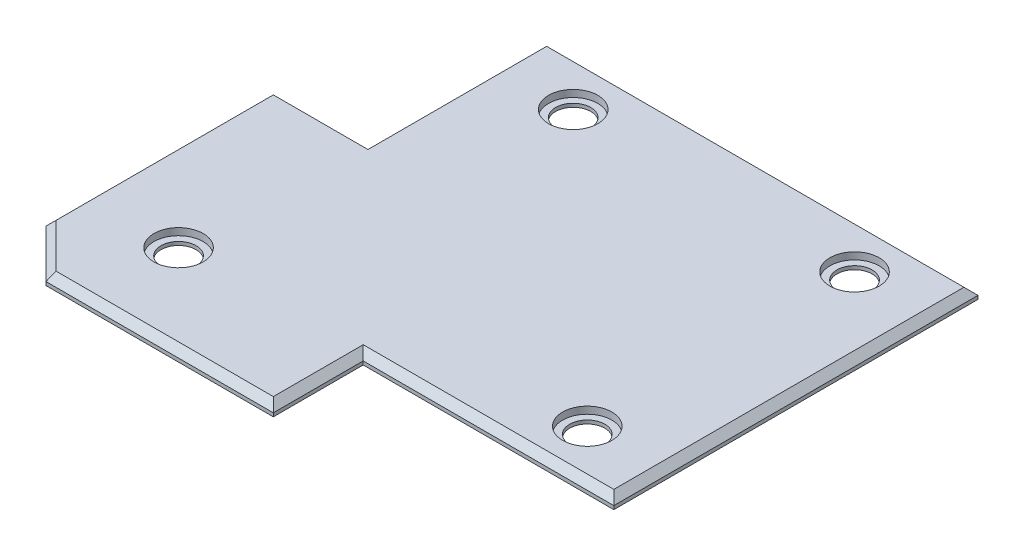
from build123d import *

# Parameters (mm, degrees)
BOSS_EXTRUDE1_DEPTH = 2
CHAMFER1_SIZE       = 8
BOSS_EXTRUDE2_DEPTH = 1.5
SKETCH4_W           = 99.768826376
SKETCH4_H           = 91.588754032
CUT_EXTRUDE1_DEPTH  = 2
SKETCH5_R           = 2.5
CUT_EXTRUDE2_DEPTH  = 2
SKETCH8_R           = 3.5
CUT_EXTRUDE3_DEPTH  = 1
CHAMFER2_SIZE       = 1


with BuildPart() as part:
    # Sketch1 → Boss-Extrude1 (new body)
    with BuildSketch(Plane(origin=(0, 0, 0), x_dir=(1, 0, 0), z_dir=(0, 1, 0))):
        Polygon((-1.782487159, -28.34466675), (33.85093234, -28.34466675), (33.85093234, 27.435918205), (-31.480603593, 27.435918205), (-31.480603593, 2.026433414), (-44.933505709, 2.026433414), (-44.933505709, -41.124585136), (-1.782487159, -41.124585136), align=None)
    extrude(amount=BOSS_EXTRUDE1_DEPTH)

    # Chamfer1
    chamfer1_edges = [part.edges().sort_by_distance(p)[0] for p in [
        (-44.933505709, 1, 41.124585136),
    ]]
    chamfer(chamfer1_edges, length=CHAMFER1_SIZE)

    # Sketch3 → Boss-Extrude2 (add)
    with BuildSketch(Plane(origin=(0, 2, 0), x_dir=(1, 0, 0), z_dir=(0, 1, 0))):
        Polygon((-29.480603593, 25.435918205), (31.85093234, 25.435918205), (31.85093234, -26.34466675), (-3.782487159, -26.34466675), (-3.782487159, -39.124585136), (-36.105078585, -39.124585136), (-42.933505709, -32.296158012), (-42.933505709, 0.026433414), (-29.480603593, 0.026433414), align=None)
    extrude(amount=BOSS_EXTRUDE2_DEPTH)

    # Sketch4 → Cut-Extrude1 (cut)
    with BuildSketch(Plane.XZ):
        Rectangle(SKETCH4_W, SKETCH4_H)
    extrude(amount=-CUT_EXTRUDE1_DEPTH, mode=Mode.SUBTRACT)

    # Sketch5 → Cut-Extrude2 (cut)
    with BuildSketch(Plane(origin=(0, 3.5, 0), x_dir=(1, 0, 0), z_dir=(0, 1, 0))):
        with Locations(Location((-18.814835626, 18.545625727, 0), (0, 0, 270))):
            Circle(SKETCH5_R)
        with Locations(Location((21.185164374, 18.545625727, 0), (0, 0, 270))):
            Circle(SKETCH5_R)
        with Locations(Location((21.185164374, -19.454374273, 0), (0, 0, 270))):
            Circle(SKETCH5_R)
        with Locations(Location((-29.854835626, -26.529137879, 0), (0, 0, 270))):
            Circle(SKETCH5_R)
    extrude(amount=-CUT_EXTRUDE2_DEPTH, mode=Mode.SUBTRACT)

    # Sketch8 → Cut-Extrude3 (cut)
    with BuildSketch(Plane(origin=(0, 3.5, 0), x_dir=(1, 0, 0), z_dir=(0, 1, 0))):
        with Locations(Location((-18.814835626, 18.545625727, 0), (0, 0, 270))):
            Circle(SKETCH8_R)
        with Locations(Location((21.185164374, 18.545625727, 0), (0, 0, 270))):
            Circle(SKETCH8_R)
        with Locations(Location((-29.854835626, -26.529137879, 0), (0, 0, 270))):
            Circle(SKETCH8_R)
        with Locations(Location((21.185164374, -19.454374273, 0), (0, 0, 270))):
            Circle(SKETCH8_R)
    extrude(amount=-CUT_EXTRUDE3_DEPTH, mode=Mode.SUBTRACT)

    # Chamfer2
    chamfer2_edges = [part.edges().sort_by_distance(p)[0] for p in [
        (-29.480603593, 3.5, -12.731175809),
        (-36.207054651, 3.5, -0.026433414),
        (-42.933505709, 3.5, 16.134862299),
        (-39.519292147, 3.5, 35.710371574),
        (-19.943782872, 3.5, 39.124585136),
        (-3.782487159, 3.5, 32.734625943),
        (14.034222591, 3.5, 26.34466675),
        (31.85093234, 3.5, 0.454374273),
        (1.185164374, 3.5, -25.435918205),
    ]]
    chamfer(chamfer2_edges, length=CHAMFER2_SIZE)


solid = part.part
